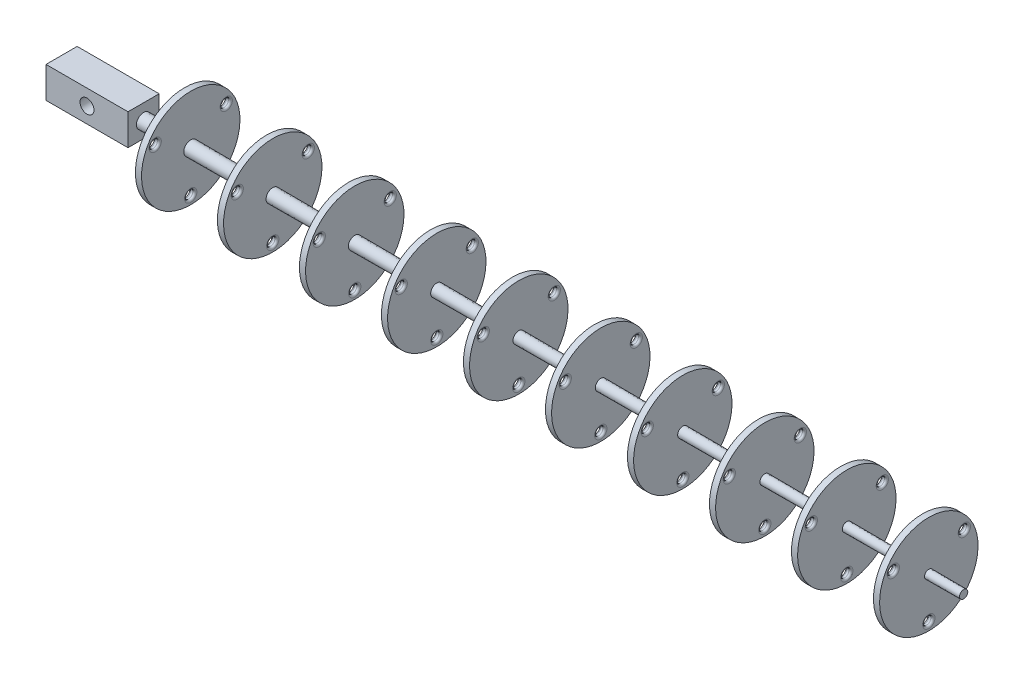
from build123d import *

# Parameters (mm, degrees)
SKETCH3_W                      = 1.5
SKETCH3_H                      = 12
CUT_EXTRUDE1_REACH             = 191.262
SKETCH5_R                      = 1
FILLET1_R                      = 0.5
LPATTERN1_COUNT                = 10
LPATTERN1_PITCH                = 20
FILLET1_OF_LPATTERN1_R         = 0.5
SKETCH16_W                     = 7.6
SKETCH16_H                     = 7.6
BOSS_EXTRUDE1_DEPTH            = 20
M3_CLEARANCE_HOLE1_D           = 3.4
M3_CLEARANCE_HOLE1_CSINK_D     = 3.45
M3_CLEARANCE_HOLE1_CSINK_ANGLE = 90


with BuildPart() as part:
    # Sketch2 → Revolve1 (revolve)
    with BuildSketch(Plane.XY):
        Polygon((0, 1.75), (200, 1), (200, 0), (0, 0), align=None)
    revolve(axis=Axis((200, 0, 0), (-1, 0, 0)))

    # Sketch3 → Revolve2 (revolve)
    with BuildSketch(Plane.XY):
        with Locations((10.75, 6)):
            Rectangle(SKETCH3_W, SKETCH3_H)
    revolve2 = revolve(axis=Axis((11.5, 0, 0), (-1, 0, 0)))

    # Sketch5 → Cut-Extrude1 (cut, up to next)
    with BuildSketch(Plane(origin=(11.5, 0, 0), x_dir=(0, 0, -1), z_dir=(1, 0, 0)), mode=Mode.PRIVATE) as cut_extrude1_sk1:
        with Locations((0, -10)):
            Circle(SKETCH5_R)
    cut_extrude1_tool1 = extrude(cut_extrude1_sk1.sketch, amount=-CUT_EXTRUDE1_REACH, mode=Mode.PRIVATE) & part.part
    # Sketch5 → Cut-Extrude1 (cut, up to next)
    with BuildSketch(Plane(origin=(11.5, 0, 0), x_dir=(0, 0, -1), z_dir=(1, 0, 0)), mode=Mode.PRIVATE) as cut_extrude1_sk2:
        with Locations((8.660254038, 5)):
            Circle(SKETCH5_R)
    cut_extrude1_tool2 = extrude(cut_extrude1_sk2.sketch, amount=-CUT_EXTRUDE1_REACH, mode=Mode.PRIVATE) & part.part
    # Sketch5 → Cut-Extrude1 (cut, up to next)
    with BuildSketch(Plane(origin=(11.5, 0, 0), x_dir=(0, 0, -1), z_dir=(1, 0, 0)), mode=Mode.PRIVATE) as cut_extrude1_sk3:
        with Locations((-8.660254038, 5)):
            Circle(SKETCH5_R)
    cut_extrude1_tool3 = extrude(cut_extrude1_sk3.sketch, amount=-CUT_EXTRUDE1_REACH, mode=Mode.PRIVATE) & part.part
    cut_extrude1_1 = cut_extrude1_tool1.solids().sort_by_distance((11.5, -10, 0))[0]
    add(cut_extrude1_1, mode=Mode.SUBTRACT)
    cut_extrude1_2 = cut_extrude1_tool2.solids().sort_by_distance((11.5, 5, -8.660254))[0]
    add(cut_extrude1_2, mode=Mode.SUBTRACT)
    cut_extrude1_3 = cut_extrude1_tool3.solids().sort_by_distance((11.5, 5, 8.660254))[0]
    add(cut_extrude1_3, mode=Mode.SUBTRACT)
    cut_extrude1 = cut_extrude1_1 + cut_extrude1_2 + cut_extrude1_3  # Cut-Extrude1 as one shape, for the pattern or mirror that repeats it

    # Fillet1
    fillet1_edges = [part.edges().sort_by_distance(p)[0] for p in [
        (10, 5, -7.660254038),
        (10, -10, 1),
        (11.5, -10, 1),
        (11.5, 5, -7.660254038),
        (10, 5, 9.660254038),
        (11.5, 5, 9.660254038),
    ]]
    fillet(fillet1_edges, radius=FILLET1_R)

    # LPattern1: Revolve2, Cut-Extrude1 ×10
    with Locations(*[(i * LPATTERN1_PITCH, 0, 0) for i in range(1, LPATTERN1_COUNT)]):
        add(revolve2)
        add(cut_extrude1, mode=Mode.SUBTRACT)

    # Fillet1 of LPattern1
    fillet1_of_lpattern1_edges = [part.edges().sort_by_distance(p)[0] for p in [
        (30, 5, -7.660254038),
        (30, -10, 1),
        (31.5, -10, 1),
        (31.5, 5, -7.660254038),
        (30, 5, 9.660254038),
        (31.5, 5, 9.660254038),
        (50, 5, -7.660254038),
        (50, -10, 1),
        (51.5, -10, 1),
        (51.5, 5, -7.660254038),
        (50, 5, 9.660254038),
        (51.5, 5, 9.660254038),
        (70, 5, -7.660254038),
        (70, -10, 1),
        (71.5, -10, 1),
        (71.5, 5, -7.660254038),
        (70, 5, 9.660254038),
        (71.5, 5, 9.660254038),
        (90, 5, -7.660254038),
        (90, -10, 1),
        (91.5, -10, 1),
        (91.5, 5, -7.660254038),
        (90, 5, 9.660254038),
        (91.5, 5, 9.660254038),
        (110, 5, -7.660254038),
        (110, -10, 1),
        (111.5, -10, 1),
        (111.5, 5, -7.660254038),
        (110, 5, 9.660254038),
        (111.5, 5, 9.660254038),
        (130, 5, -7.660254038),
        (130, -10, 1),
        (131.5, -10, 1),
        (131.5, 5, -7.660254038),
        (130, 5, 9.660254038),
        (131.5, 5, 9.660254038),
        (150, 5, -7.660254038),
        (150, -10, 1),
        (151.5, -10, 1),
        (151.5, 5, -7.660254038),
        (150, 5, 9.660254038),
        (151.5, 5, 9.660254038),
        (170, 5, -7.660254038),
        (170, -10, 1),
        (171.5, -10, 1),
        (171.5, 5, -7.660254038),
        (170, 5, 9.660254038),
        (171.5, 5, 9.660254038),
        (190, 5, -7.660254038),
        (190, -10, 1),
        (191.5, -10, 1),
        (191.5, 5, -7.660254038),
        (190, 5, 9.660254038),
        (191.5, 5, 9.660254038),
    ]]
    fillet(fillet1_of_lpattern1_edges, radius=FILLET1_OF_LPATTERN1_R)

    # Sketch16 → Boss-Extrude1 (add)
    with BuildSketch(Plane.ZY):
        Rectangle(SKETCH16_W, SKETCH16_H)
    extrude(amount=BOSS_EXTRUDE1_DEPTH)

    # M3 Clearance Hole1 (through all)
    with Locations(Plane(origin=(0, 0, -3.8), x_dir=(-1, 0, 0), z_dir=(0, 0, -1))):
        with Locations((10, 0)):
            CounterSinkHole(M3_CLEARANCE_HOLE1_D / 2, M3_CLEARANCE_HOLE1_CSINK_D / 2, counter_sink_angle=M3_CLEARANCE_HOLE1_CSINK_ANGLE)


solid = part.part
